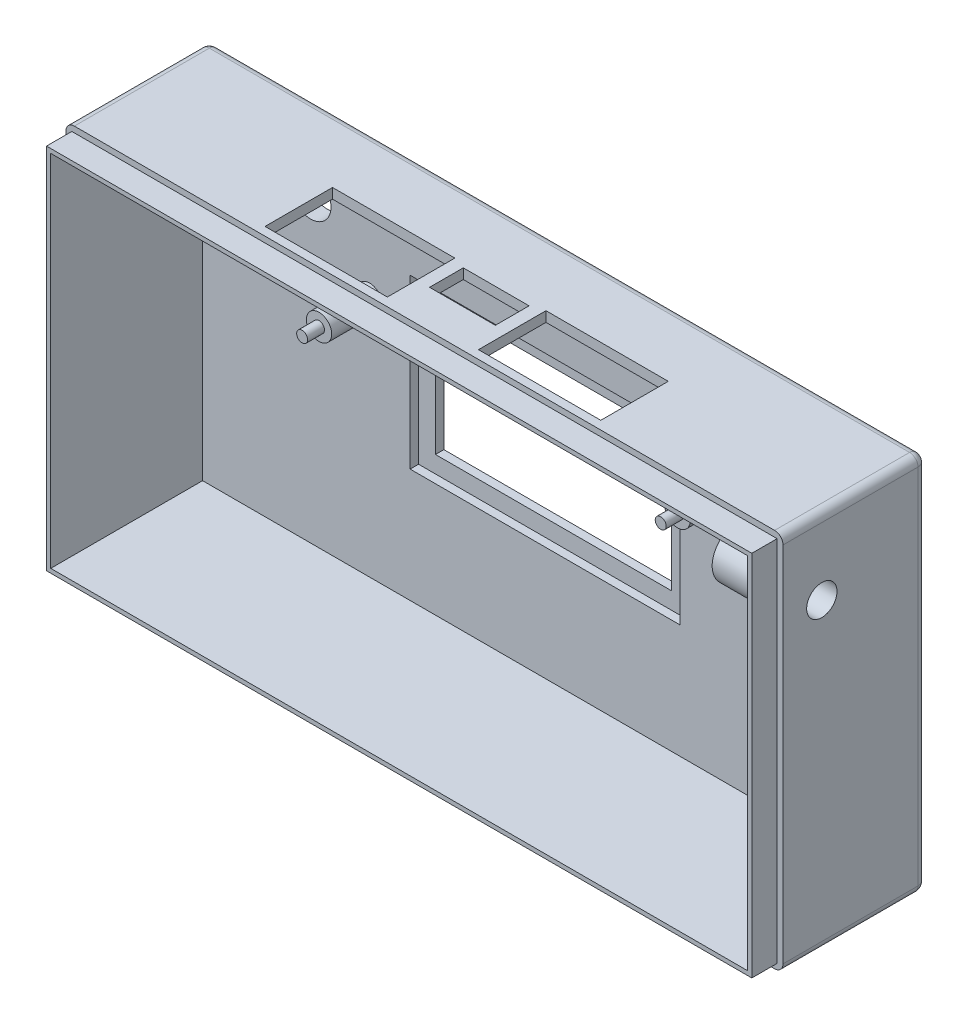
from build123d import *

# Parameters (mm, degrees)
SKETCH_1_W          = 85
SKETCH_1_H          = 45
EXTRUDE_1_DEPTH     = 20
SKETCH_2_W          = 82.6
SKETCH_2_H          = 42.6
CUT_EXTRUDE_1_DEPTH = 18
SKETCH_3_R          = 52.564832307
SKETCH_3_W          = 83.6
SKETCH_3_H          = 43.6
CUT_EXTRUDE_2_DEPTH = 3
SKETCH_4_R          = 1.5
CUT_EXTRUDE_3_DEPTH = 10
SKETCH_6_R          = 1.5
EXTRUDE_2_DEPTH     = 6
SKETCH_7_R          = 0.65
EXTRUDE_3_DEPTH     = 2
SKETCH_5_W          = 28
SKETCH_5_H          = 15.9
CUT_EXTRUDE_4_DEPTH = 99.234413522
SKETCH_9_W          = 32
SKETCH_9_H          = 19.9
CUT_EXTRUDE_5_DEPTH = 1
SKETCH_10_W         = 14.5
SKETCH_10_H         = 8
SKETCH_10_W_2       = 7.8
SKETCH_10_H_2       = 4
CUT_EXTRUDE_6_DEPTH = 10
FILLET_1_R          = 1
SKETCH_11_R         = 1.8
EXTRUDE_4_DEPTH     = 10
SKETCH_12_R         = 1.8
CUT_EXTRUDE_7_DEPTH = 90.721792225
SKETCH_13_R         = 2.425
CUT_EXTRUDE_8_DEPTH = 98.846819059


with BuildPart() as part:
    # Эскиз1 → Бобышка-Вытянуть1 (new body)
    with BuildSketch(Plane.XY):
        with Locations((42.5, 22.5)):
            Rectangle(SKETCH_1_W, SKETCH_1_H)
    extrude(amount=EXTRUDE_1_DEPTH)

    # Эскиз2 → Вырез-Вытянуть1 (cut)
    with BuildSketch(Plane.XY.offset(20)):
        with Locations((42.5, 22.5)):
            Rectangle(SKETCH_2_W, SKETCH_2_H)
    extrude(amount=-CUT_EXTRUDE_1_DEPTH, mode=Mode.SUBTRACT)

    # Эскиз3 → Вырез-Вытянуть2 (cut)
    with BuildSketch(Plane.XY.offset(20)):
        with Locations((42.5, 22.5)):
            Circle(SKETCH_3_R)
        with Locations((42.5, 22.5)):
            Rectangle(SKETCH_3_W, SKETCH_3_H, mode=Mode.SUBTRACT)
    extrude(amount=-CUT_EXTRUDE_2_DEPTH, mode=Mode.SUBTRACT)

    # Эскиз4 → Вырез-Вытянуть3 (cut)
    with BuildSketch(Plane.ZY.offset(-85)):
        with Locations(Location((12.4, 36.05, 0), (0, 0, 180))):
            Circle(SKETCH_4_R)
    extrude(amount=CUT_EXTRUDE_3_DEPTH, mode=Mode.SUBTRACT)

    # Эскиз6 → Бобышка-Вытянуть2 (add)
    with BuildSketch(Plane.XY.offset(2)):
        with Locations((21, 29.89)):
            Circle(SKETCH_6_R)
        with Locations((63.5, 32)):
            Circle(SKETCH_6_R)
    extrude(amount=EXTRUDE_2_DEPTH)

    # Эскиз7 → Бобышка-Вытянуть3 (add)
    with BuildSketch(Plane.XY.offset(8)):
        with Locations((21, 29.89)):
            Circle(SKETCH_7_R)
        with Locations((63.5, 32)):
            Circle(SKETCH_7_R)
    extrude(amount=EXTRUDE_3_DEPTH)

    # Эскиз5 → Вырез-Вытянуть4 (cut, through all)
    with BuildSketch(Plane(origin=(0, 0, 0), x_dir=(-1, 0, 0), z_dir=(0, 0, -1))):
        with Locations((-41.8, 24.64)):
            Rectangle(SKETCH_5_W, SKETCH_5_H)
    extrude(amount=-CUT_EXTRUDE_4_DEPTH, mode=Mode.SUBTRACT)

    # Эскиз9 → Вырез-Вытянуть5 (cut)
    with BuildSketch(Plane.XY.offset(2)):
        with Locations((41.8, 24.64)):
            Rectangle(SKETCH_9_W, SKETCH_9_H)
    extrude(amount=-CUT_EXTRUDE_5_DEPTH, mode=Mode.SUBTRACT)

    # Эскиз10 → Вырез-Вытянуть6 (cut)
    with BuildSketch(Plane.XZ.offset(-45)):
        with Locations((29.85, 12)):
            Rectangle(SKETCH_10_W, SKETCH_10_H)
        with Locations((55.15, 12)):
            Rectangle(SKETCH_10_W, SKETCH_10_H)
        with Locations((42.5, 10.5)):
            Rectangle(SKETCH_10_W_2, SKETCH_10_H_2)
    extrude(amount=CUT_EXTRUDE_6_DEPTH, mode=Mode.SUBTRACT)

    # Скругление1
    fillet_1_edges = [part.edges().sort_by_distance(p)[0] for p in [
        (0, 45, 8.5),
        (85, 45, 8.5),
        (85, 0, 8.5),
        (0, 0, 8.5),
        (42.5, 45, 0),
        (85, 22.5, 0),
        (42.5, 0, 0),
        (0, 22.5, 0),
    ]]
    fillet(fillet_1_edges, radius=FILLET_1_R)

    # Эскиз11 → Бобышка-Вытянуть4 (add)
    with BuildSketch(Plane.ZY.offset(-85)):
        with BuildLine():
            Line((1, 37.8), (1, 34.3))
            Line((1, 34.3), (10.741687605, 33.55))
            ThreePointArc((10.741687605, 33.55), (15.4, 36.05), (10.741687605, 38.55))
            Line((10.741687605, 38.55), (1, 37.8))
        make_face()
        with Locations(Location((12.4, 36.05, 0), (0, 0, 180))):
            Circle(SKETCH_11_R, mode=Mode.SUBTRACT)
    extrude(amount=EXTRUDE_4_DEPTH)

    # Эскиз12 → Вырез-Вытянуть7 (cut, through all)
    with BuildSketch(Plane.ZY.offset(-75)):
        with Locations(Location((12.4, 36.05, 0), (0, 0, 180))):
            Circle(SKETCH_12_R)
    extrude(amount=-CUT_EXTRUDE_7_DEPTH, mode=Mode.SUBTRACT)

    # Эскиз13 → Вырез-Вытянуть8 (cut, through all)
    with BuildSketch(Plane.XY.offset(2)):
        with Locations((14, 36.89)):
            Circle(SKETCH_13_R)
    extrude(amount=-CUT_EXTRUDE_8_DEPTH, mode=Mode.SUBTRACT)


solid = part.part
